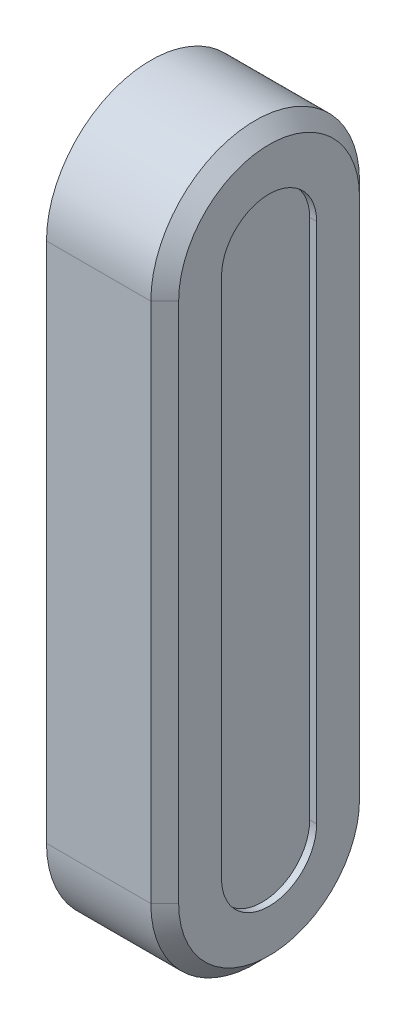
from build123d import *

# Parameters (mm, degrees)
SKETCH_1_R          = 4.9
EXTRUDE_1_DEPTH     = 10
EXTRUDE_2_DEPTH     = 20
SKETCH_3_R          = 5
EXTRUDE_3_DEPTH     = 20
CHAMFER_1_SIZE      = 2
CUT_EXTRUDE_1_DEPTH = 1
SKETCH_5_W          = 112.212059924
SKETCH_5_H          = 221.512042167
CUT_EXTRUDE_2_DEPTH = 23
CUT_EXTRUDE_3_DEPTH = 14


with BuildPart() as part:
    # 草图1 → 凸台-拉伸1 (new body)
    with BuildSketch(Plane(origin=(0, 0, 0), x_dir=(0, 0, -1), z_dir=(1, 0, 0))):
        Circle(SKETCH_1_R)
    extrude(amount=EXTRUDE_1_DEPTH)

    # 草图2 → 凸台-拉伸2 (add)
    with BuildSketch(Plane(origin=(10, 0, 0), x_dir=(0, 0, -1), z_dir=(1, 0, 0))):
        with BuildLine():
            Line((15, 0), (15, -75))
            ThreePointArc((15, -75), (0, -90), (-15, -75))
            Line((-15, -75), (-15, 0))
            ThreePointArc((-15, 0), (0, 15), (15, 0))
        make_face()
    extrude(amount=EXTRUDE_2_DEPTH)

    # 草图3 → 凸台-拉伸3 (add)
    with BuildSketch(Plane.ZY.offset(-10)):
        with Locations(Location((0, -75, 0), (0, 0, 180))):
            Circle(SKETCH_3_R)
    extrude(amount=EXTRUDE_3_DEPTH)

    # 倒角1
    chamfer_1_edges = [part.edges().sort_by_distance(p)[0] for p in [
        (10, -37.5, 15),
        (10, -90, 0),
        (30, -37.5, -15),
        (10, 15, 0),
        (30, -37.5, 15),
        (30, -90, 0),
        (30, 15, 0),
        (10, -37.5, -15),
    ]]
    chamfer(chamfer_1_edges, length=CHAMFER_1_SIZE)

    # 草图4 → 切除-拉伸1 (cut)
    with BuildSketch(Plane(origin=(30, 0, 0), x_dir=(0, 0, -1), z_dir=(1, 0, 0))):
        with BuildLine():
            Line((6.835634275, 0), (6.835634275, -75))
            ThreePointArc((6.835634275, -75), (0, -81.835634275), (-6.835634275, -75))
            Line((-6.835634275, -75), (-6.835634275, 0))
            ThreePointArc((-6.835634275, 0), (0, 6.835634275), (6.835634275, 0))
        make_face()
    extrude(amount=-CUT_EXTRUDE_1_DEPTH, mode=Mode.SUBTRACT)

    # 草图5 → 切除-拉伸2 (cut)
    with BuildSketch(Plane.ZY.offset(10)):
        with Locations((-34.944932156, -94.819395662)):
            Rectangle(SKETCH_5_W, SKETCH_5_H)
    extrude(amount=-CUT_EXTRUDE_2_DEPTH, mode=Mode.SUBTRACT)

    # 草图6 → 切除-拉伸3 (cut)
    with BuildSketch(Plane.ZY.offset(-13)):
        with BuildLine():
            Line((13, 0), (13, -75))
            ThreePointArc((13, -75), (0, -88), (-13, -75))
            Line((-13, -75), (-13, 0))
            ThreePointArc((-13, 0), (0, 13), (13, 0))
        make_face()
    extrude(amount=-CUT_EXTRUDE_3_DEPTH, mode=Mode.SUBTRACT)


solid = part.part
